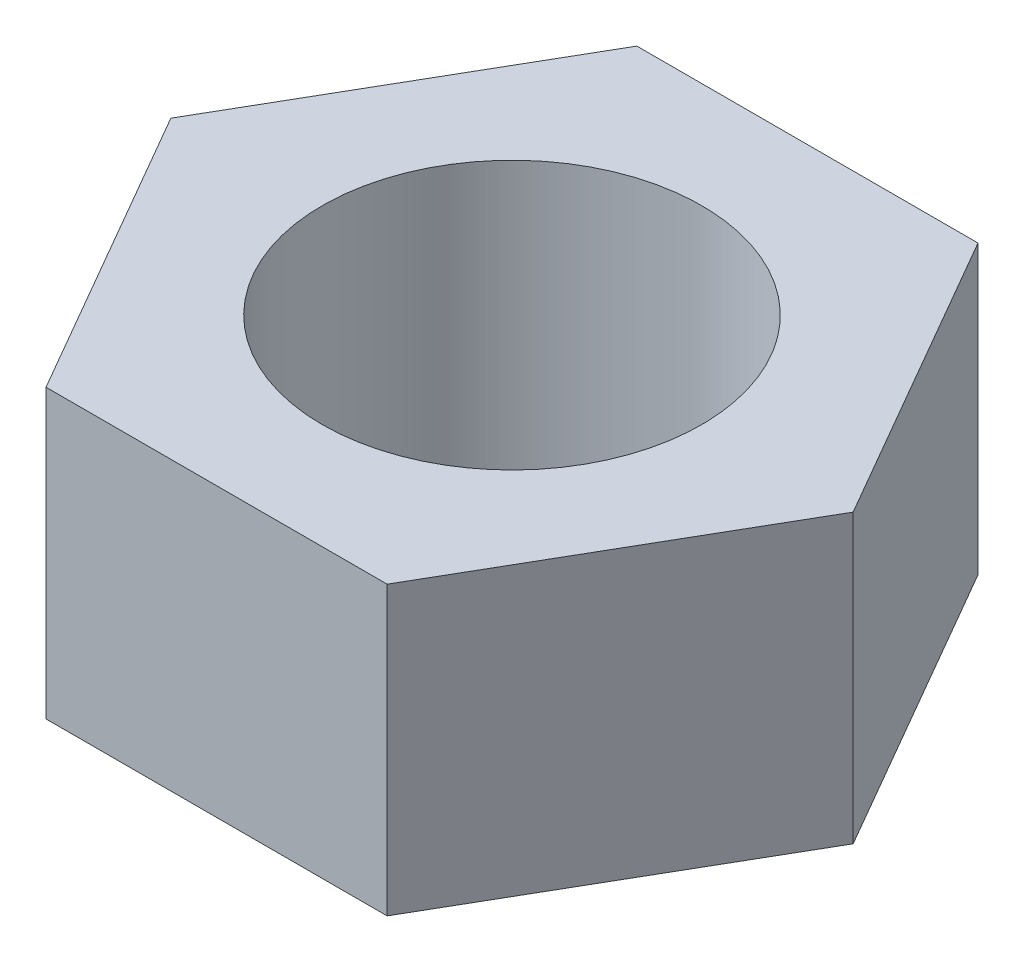
from build123d import *

# Parameters (mm, degrees)
SKETCH1_R           = 3.5
BOSS_EXTRUDE1_DEPTH = 5.3


with BuildPart() as part:
    # Sketch1 → Boss-Extrude1 (new body)
    with BuildSketch(Plane(origin=(0, 0, 0), x_dir=(1, 0, 0), z_dir=(0, 1, 0))):
        Polygon((3.146558967, -5.45), (6.293117934, 0), (3.146558967, 5.45), (-3.146558967, 5.45), (-6.293117934, 0), (-3.146558967, -5.45), align=None)
        with Locations(Location((0, 0, 0), (0, 0, 270))):
            Circle(SKETCH1_R, mode=Mode.SUBTRACT)
    extrude(amount=BOSS_EXTRUDE1_DEPTH)


solid = part.part
